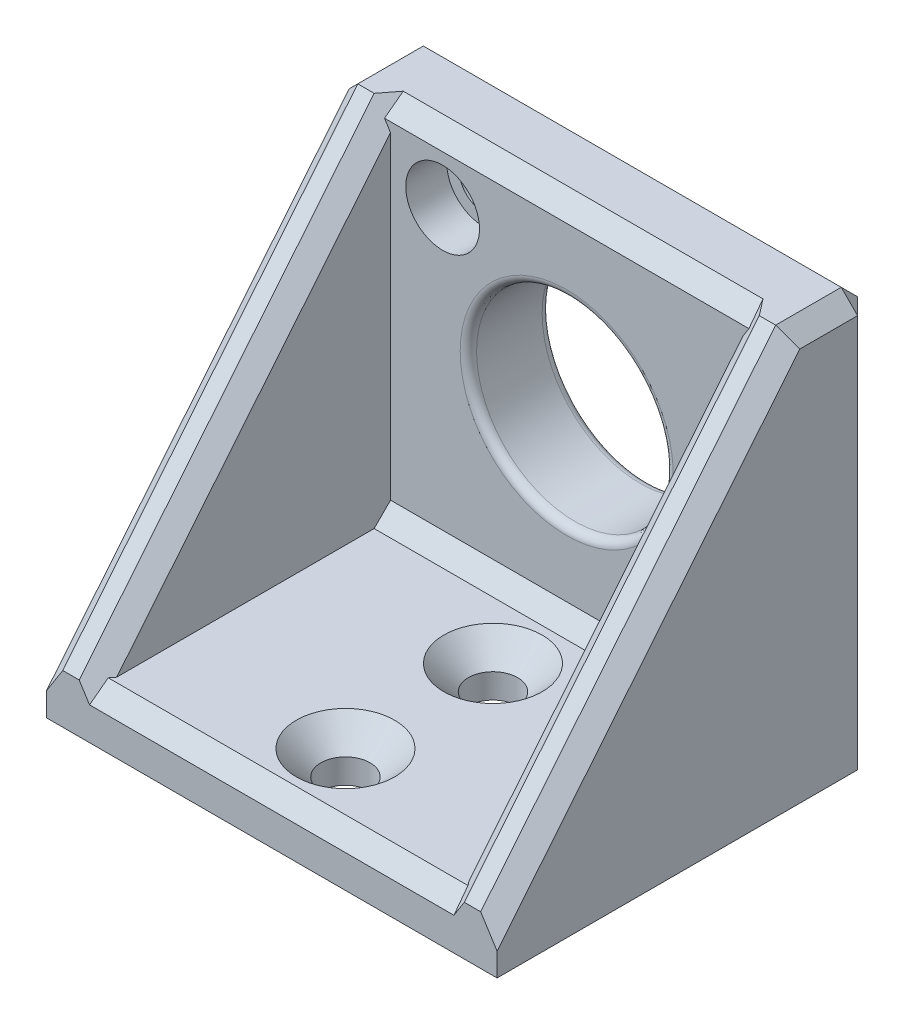
from build123d import *

# Parameters (mm, degrees)
ESBO_O1_W                = 27.5
ESBO_O1_H                = 25
RESSALTO_EXTRUS_O1_DEPTH = 5
ESBO_O2_W                = 27.5
ESBO_O2_H                = 3
RESSALTO_EXTRUS_O2_DEPTH = 18
RESSALTO_EXTRUS_O3_DEPTH = 3
RESSALTO_EXTRUS_O4_DEPTH = 3
ESBO_O5_R                = 1.5
CORTE_EXTRUS_O1_DEPTH    = 5
CHANFRO1_SIZE            = 1.5
CHANFRO2_SIZE            = 1
CHANFRO4_SIZE            = 1
CHANFRO5_SIZE            = 1
ESBO_O6_R                = 6
ESBO_O6_R_2              = 1.5
CORTE_EXTRUS_O2_DEPTH    = 5
FILETE1_R                = 0.5
ESBO_O8_R                = 2.25
CORTE_EXTRUS_O3_DEPTH    = 2.5


with BuildPart() as part:
    # Esboço1 → Ressalto-extrusão1 (new body)
    with BuildSketch(Plane.XY):
        Rectangle(ESBO_O1_W, ESBO_O1_H)
    extrude(amount=RESSALTO_EXTRUS_O1_DEPTH)

    # Esboço2 → Ressalto-extrusão2 (add)
    with BuildSketch(Plane.XY.offset(5)):
        with Locations((0, -11)):
            Rectangle(ESBO_O2_W, ESBO_O2_H)
    extrude(amount=RESSALTO_EXTRUS_O2_DEPTH)

    # Esboço3 → Ressalto-extrusão3 (add)
    with BuildSketch(Plane(origin=(13.75, 0, 0), x_dir=(0, 0, -1), z_dir=(1, 0, 0))):
        Polygon((-5, 12.5), (-23, -9.5), (-5, -9.5), align=None)
    extrude(amount=-RESSALTO_EXTRUS_O3_DEPTH)

    # Esboço4 → Ressalto-extrusão4 (add)
    with BuildSketch(Plane.ZY.offset(13.75)):
        Polygon((5, 12.5), (5, -9.5), (23, -9.5), align=None)
    extrude(amount=-RESSALTO_EXTRUS_O4_DEPTH)

    # Esboço5 → Corte-extrusão1 (cut)
    with BuildSketch(Plane(origin=(0, -9.5, 0), x_dir=(1, 0, 0), z_dir=(0, 1, 0))):
        with Locations(Location((0, -9.5, 0), (0, 0, 270))):
            Circle(ESBO_O5_R)
        with Locations(Location((0, -18.5, 0), (0, 0, 270))):
            Circle(ESBO_O5_R)
    extrude(amount=-CORTE_EXTRUS_O1_DEPTH, mode=Mode.SUBTRACT)

    # Chanfro1
    chanfro1_edges = [part.edges().sort_by_distance(p)[0] for p in [
        (0, -9.5, 8),
        (0, -9.5, 17),
    ]]
    chamfer(chanfro1_edges, length=CHANFRO1_SIZE)

    # Chanfro2
    chanfro2_edges = [part.edges().sort_by_distance(p)[0] for p in [
        (13.75, 1.5, 14),
        (-13.75, 1.5, 14),
        (0, 12.5, 0),
        (13.75, 0, 0),
        (-13.75, 0, 0),
        (-13.75, 12.5, 2.5),
        (13.75, 12.5, 2.5),
    ]]
    chamfer(chanfro2_edges, length=CHANFRO2_SIZE)

    # Chanfro4
    chanfro4_edges = [part.edges().sort_by_distance(p)[0] for p in [
        (10.75, 1.5, 14),
        (-10.75, 1.5, 14),
    ]]
    chamfer(chanfro4_edges, length=CHANFRO4_SIZE)

    # Chanfro5
    chanfro5_edges = [part.edges().sort_by_distance(p)[0] for p in [
        (0, -9.5, 23),
        (0, -9.5, 5),
        (0, 12.5, 5),
    ]]
    chamfer(chanfro5_edges, length=CHANFRO5_SIZE)

    # Esboço6 → Corte-extrusão2 (cut)
    with BuildSketch(Plane.XY.offset(5)):
        with Locations((0, 1.5)):
            Circle(ESBO_O6_R)
        with Locations((-7.571529996, 8.543317004)):
            Circle(ESBO_O6_R_2)
    extrude(amount=-CORTE_EXTRUS_O2_DEPTH, mode=Mode.SUBTRACT)

    # Filete1
    filete1_edges = [part.edges().sort_by_distance(p)[0] for p in [
        (-6, 1.5, 0),
        (-6, 1.5, 5),
    ]]
    fillet(filete1_edges, radius=FILETE1_R)

    # Esboço8 → Corte-extrusão3 (cut)
    with BuildSketch(Plane.XY.offset(5)):
        with Locations((-7.571529996, 8.543317004)):
            Circle(ESBO_O8_R)
    extrude(amount=-CORTE_EXTRUS_O3_DEPTH, mode=Mode.SUBTRACT)


solid = part.part
